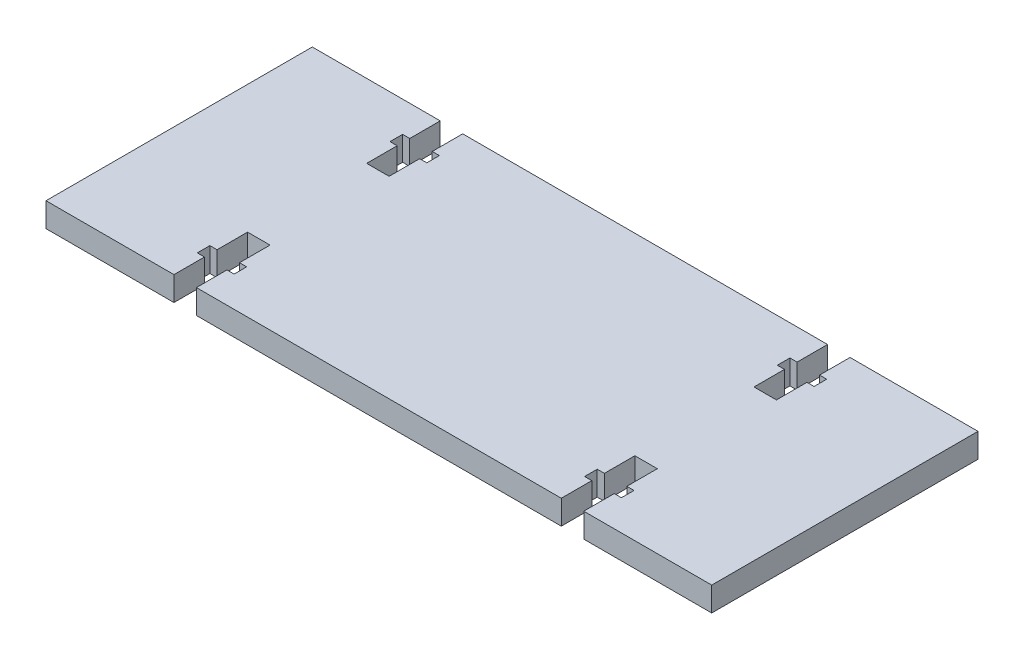
from build123d import *

# Parameters (mm, degrees)
SKETCH1_W           = 87.3125
SKETCH1_H           = 34.925
BOSS_EXTRUDE1_DEPTH = 3.175
CUT_EXTRUDE2_DEPTH  = 48.126295158


with BuildPart() as part:
    # Sketch1 → Boss-Extrude1 (new body)
    with BuildSketch(Plane(origin=(0, 0, 0), x_dir=(1, 0, 0), z_dir=(0, 1, 0))):
        Rectangle(SKETCH1_W, SKETCH1_H)
    extrude(amount=BOSS_EXTRUDE1_DEPTH)

    # Sketch3 → Cut-Extrude2 (cut, through all)
    with BuildSketch(Plane.XZ):
        Polygon((-26.8732, 17.4625), (-23.9268, 17.4625), (-23.9268, 13.462), (-22.987, 13.462), (-22.987, 11.811), (-23.9268, 11.811), (-23.9268, 7.8105), (-26.8732, 7.8105), (-26.8732, 11.811), (-27.813, 11.811), (-27.813, 13.462), (-26.8732, 13.462), align=None)
        Polygon((26.8732, 11.811), (26.8732, 7.8105), (23.9268, 7.8105), (23.9268, 11.811), (22.987, 11.811), (22.987, 13.462), (23.9268, 13.462), (23.9268, 17.4625), (26.8732, 17.4625), (26.8732, 13.462), (27.813, 13.462), (27.813, 11.811), align=None)
        Polygon((26.8732, -17.4625), (23.9268, -17.4625), (23.9268, -13.462), (22.987, -13.462), (22.987, -11.811), (23.9268, -11.811), (23.9268, -7.8105), (26.8732, -7.8105), (26.8732, -11.811), (27.813, -11.811), (27.813, -13.462), (26.8732, -13.462), align=None)
        Polygon((-26.8732, -11.811), (-26.8732, -7.8105), (-23.9268, -7.8105), (-23.9268, -11.811), (-22.987, -11.811), (-22.987, -13.462), (-23.9268, -13.462), (-23.9268, -17.4625), (-26.8732, -17.4625), (-26.8732, -13.462), (-27.813, -13.462), (-27.813, -11.811), align=None)
    extrude(amount=-CUT_EXTRUDE2_DEPTH, mode=Mode.SUBTRACT)


solid = part.part
